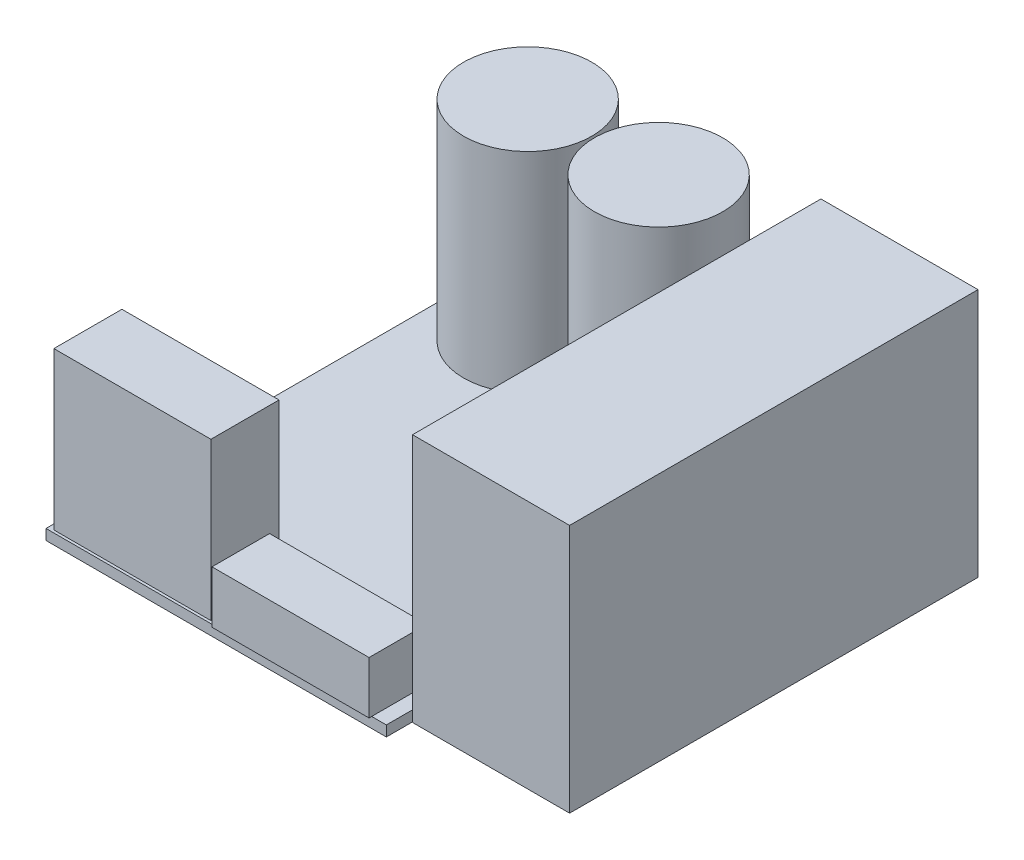
from build123d import *

# Parameters (mm, degrees)
SKETCH1_W           = 65
SKETCH1_H           = 98
SKETCH1_R           = 1.75
SKETCH1_W_2         = 5.703642488
SKETCH1_H_2         = 7.830424434
SKETCH1_H_3         = 8.120440153
BOSS_EXTRUDE1_DEPTH = 2
SKETCH2_W           = 15
SKETCH2_H           = 6
BOSS_EXTRUDE2_DEPTH = 10
SKETCH3_R           = 12.25
BOSS_EXTRUDE3_DEPTH = 40
SKETCH4_W           = 30
SKETCH4_H           = 13
BOSS_EXTRUDE4_DEPTH = 30
SKETCH5_W           = 30
SKETCH5_H           = 11
BOSS_EXTRUDE5_DEPTH = 10
SKETCH6_W           = 30
SKETCH6_H           = 78
BOSS_EXTRUDE6_DEPTH = 45.5
SKETCH7_W           = 30
SKETCH7_H           = 78
BOSS_EXTRUDE7_DEPTH = 2.1


with BuildPart() as part:
    # Sketch1 → Boss-Extrude1 (new body)
    with BuildSketch(Plane(origin=(0, 0, 0), x_dir=(1, 0, 0), z_dir=(0, 1, 0))):
        with Locations((32.5, -49)):
            Rectangle(SKETCH1_W, SKETCH1_H)
        with Locations(Location((4.8, -5.4, 0), (0, 0, 270))):
            Circle(SKETCH1_R, mode=Mode.SUBTRACT)
        with Locations(Location((59.2, -10.8, 0), (0, 0, 270))):
            Circle(SKETCH1_R, mode=Mode.SUBTRACT)
        with Locations(Location((19.5, -80, 0), (0, 0, 270))):
            Circle(SKETCH1_R, mode=Mode.SUBTRACT)
        with Locations(Location((47.5, -80.1, 0), (0, 0, 270))):
            Circle(SKETCH1_R, mode=Mode.SUBTRACT)
        with Locations((57.239046226, -41.024145722)):
            Rectangle(SKETCH1_W_2, SKETCH1_H_2, mode=Mode.SUBTRACT)
        with Locations((57.239046226, -70.750756999)):
            Rectangle(SKETCH1_W_2, SKETCH1_H_3, mode=Mode.SUBTRACT)
    extrude(amount=BOSS_EXTRUDE1_DEPTH)

    # Sketch2 → Boss-Extrude2 (add)
    with BuildSketch(Plane(origin=(0, 2, 0), x_dir=(1, 0, 0), z_dir=(0, 1, 0))):
        with Locations((21, -1)):
            Rectangle(SKETCH2_W, SKETCH2_H)
    extrude(amount=BOSS_EXTRUDE2_DEPTH)

    # Sketch3 → Boss-Extrude3 (add)
    with BuildSketch(Plane(origin=(0, 2, 0), x_dir=(1, 0, 0), z_dir=(0, 1, 0))):
        with Locations(Location((15, -21, 0), (0, 0, 270))):
            Circle(SKETCH3_R)
        with Locations(Location((40, -21, 0), (0, 0, 270))):
            Circle(SKETCH3_R)
    extrude(amount=BOSS_EXTRUDE3_DEPTH)

    # Sketch4 → Boss-Extrude4 (add)
    with BuildSketch(Plane(origin=(0, 2, 0), x_dir=(1, 0, 0), z_dir=(0, 1, 0))):
        with Locations((16, -91)):
            Rectangle(SKETCH4_W, SKETCH4_H)
    extrude(amount=BOSS_EXTRUDE4_DEPTH)

    # Sketch5 → Boss-Extrude5 (add)
    with BuildSketch(Plane(origin=(0, 2, 0), x_dir=(1, 0, 0), z_dir=(0, 1, 0))):
        with Locations((47.2, -93)):
            Rectangle(SKETCH5_W, SKETCH5_H)
    extrude(amount=BOSS_EXTRUDE5_DEPTH)



with BuildPart() as body_2:
    # Sketch6 → Boss-Extrude6 (new body)
    with BuildSketch(Plane(origin=(0, 2, 0), x_dir=(1, 0, 0), z_dir=(0, 1, 0))):
        with Locations((80, -54)):
            Rectangle(SKETCH6_W, SKETCH6_H)
    extrude(amount=BOSS_EXTRUDE6_DEPTH)


with BuildPart() as part_1:
    add(part.part)

    add(body_2.part)  # Boss-Extrude7 merges body 2
    # Sketch7 → Boss-Extrude7 (add)
    with BuildSketch(Plane.XZ.offset(-2)):
        with Locations((80, 54)):
            Rectangle(SKETCH7_W, SKETCH7_H)
    extrude(amount=BOSS_EXTRUDE7_DEPTH)


solid = part_1.part
